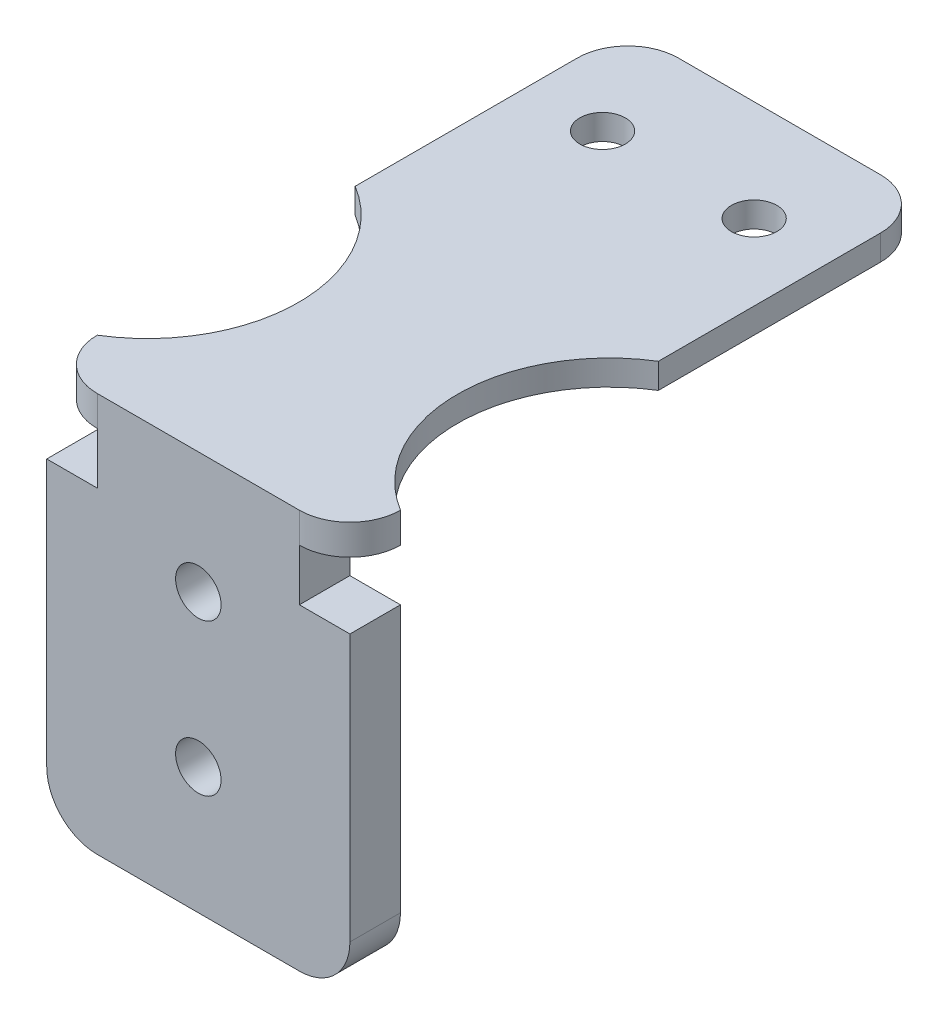
from build123d import *

# Parameters (mm, degrees)
SKETCH1_R               = 2.25
BOSS_EXTRUDE1_DEPTH     = 2.5
SKETCH3_R               = 2.25
SKETCH3_W               = 20
SKETCH3_H               = 2.5
BOSS_EXTRUDE2_DEPTH     = 5
BOSS_EXTRUDE3_DEPTH     = 3
SKETCH5_W               = 15.690952434
SKETCH5_H               = 6.78006253
BOSS_EXTRUDE4_DEPTH     = 10
CUT_EXTRUDE1_DEPTH      = 54.54884017
CUT_EXTRUDE1_DEPTH_BACK = 54.54884017
FILLET3_R               = 1


with BuildPart() as part:
    # Sketch1 → Boss-Extrude1 (new body)
    with BuildSketch(Plane(origin=(0, 0, 0), x_dir=(1, 0, 0), z_dir=(0, 1, 0))):
        with BuildLine():
            Line((15, 21.25), (15, -0.725838237))
            ThreePointArc((15, -0.725838237), (7.884185652, -13.487919119), (15, -26.25))
            Line((15, -26.25), (-15, -26.25))
            ThreePointArc((-15, -26.25), (-7.845476217, -13.487919119), (-15, -0.725838237))
            Line((-15, -0.725838237), (-15, 21.25))
            ThreePointArc((-15, 21.25), (-13.535533906, 24.785533906), (-10, 26.25))
            Line((-10, 26.25), (10, 26.25))
            ThreePointArc((10, 26.25), (13.535533906, 24.785533906), (15, 21.25))
        make_face()
        with Locations(Location((-7.5, 16.25, 0), (0, 0, 270))):
            Circle(SKETCH1_R, mode=Mode.SUBTRACT)
        with Locations(Location((7.5, 16.25, 0), (0, 0, 270))):
            Circle(SKETCH1_R, mode=Mode.SUBTRACT)
    extrude(amount=BOSS_EXTRUDE1_DEPTH)

    # Sketch3 → Boss-Extrude2 (add)
    # profile 1 of 2: a face of its own
    with BuildSketch(Plane.XY.offset(26.25)):
        with BuildLine():
            Line((10, 0), (-10, 0))
            Line((-10, 0), (-10, -5.607597834))
            Line((-10, -5.607597834), (-15, -5.607597834))
            Line((-15, -5.607597834), (-15, -32))
            ThreePointArc((-15, -32), (-13.535533906, -35.535533906), (-10, -37))
            Line((-10, -37), (10, -37))
            ThreePointArc((10, -37), (13.535533906, -35.535533906), (15, -32))
            Line((15, -32), (15, -5.607597834))
            Line((15, -5.607597834), (10, -5.607597834))
            Line((10, -5.607597834), (10, 0))
        make_face()
        with Locations((0, -24.5)):
            Circle(SKETCH3_R, mode=Mode.SUBTRACT)
        with Locations((0, -9.5)):
            Circle(SKETCH3_R, mode=Mode.SUBTRACT)
    # profile 2 of 2: a face of its own
    with BuildSketch(Plane.XY.offset(26.25)):
        with Locations((0, 1.25)):
            Rectangle(SKETCH3_W, SKETCH3_H)
    extrude(amount=BOSS_EXTRUDE2_DEPTH)

    # Sketch4 → Boss-Extrude3 (add)
    with BuildSketch(Plane(origin=(0, 2.5, 0), x_dir=(1, 0, 0), z_dir=(0, 1, 0))):
        with BuildLine():
            Line((10, -31.25), (10, -26.25))
            Line((10, -26.25), (15, -26.25))
            ThreePointArc((15, -26.25), (13.535533906, -29.785533906), (10, -31.25))
        make_face()
        with BuildLine():
            Line((-10, -31.25), (-10, -26.25))
            Line((-10, -26.25), (-15, -26.25))
            ThreePointArc((-15, -26.25), (-13.535533906, -29.785533906), (-10, -31.25))
        make_face()
    extrude(amount=-BOSS_EXTRUDE3_DEPTH)

    # Sketch5 → Boss-Extrude4 (add)
    with BuildSketch(Plane(origin=(0, 0, 26.25), x_dir=(-1, 0, 0), z_dir=(0, 0, -1))):
        with Locations((0, -3.390031265)):
            Rectangle(SKETCH5_W, SKETCH5_H)
    extrude(amount=BOSS_EXTRUDE4_DEPTH)

    # Sketch6 → Cut-Extrude1 (cut, two sides: drawn at the far end of the back side and taken through both)
    with BuildSketch(Plane(origin=(7.845476217, 0, 0), x_dir=(0, 0, -1), z_dir=(1, 0, 0)).offset(-CUT_EXTRUDE1_DEPTH_BACK)):
        with BuildLine():
            Line((-26.25, -6.78006253), (-24.66461888, -3.717189072))
            ThreePointArc((-24.66461888, -3.717189072), (-20.306619121, -2.19971294), (-16.25, 0))
            Line((-16.25, 0), (-16.25, -6.78006253))
            Line((-16.25, -6.78006253), (-26.25, -6.78006253))
        make_face()
    extrude(amount=CUT_EXTRUDE1_DEPTH + CUT_EXTRUDE1_DEPTH_BACK, mode=Mode.SUBTRACT)

    # Fillet3
    fillet3_edges = [part.edges().sort_by_distance(p)[0] for p in [
        (-7.845476217, -3.390031265, 26.25),
        (7.845476217, -3.390031265, 26.25),
    ]]
    fillet(fillet3_edges, radius=FILLET3_R)


solid = part.part
